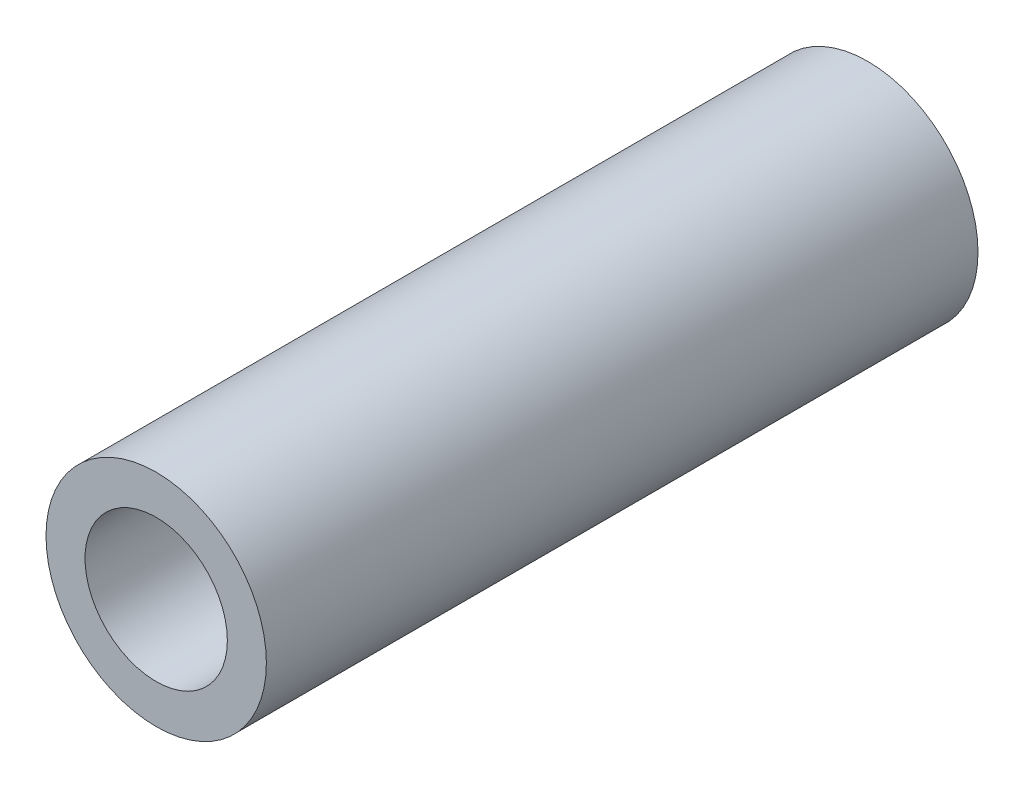
from build123d import *

# Parameters (mm, degrees)
SKETCH1_R           = 2.4
SKETCH1_R_2         = 1.55
BOSS_EXTRUDE1_DEPTH = 15.5


with BuildPart() as part:
    # Sketch1 → Boss-Extrude1 (new body)
    with BuildSketch(Plane.XY):
        Circle(SKETCH1_R)
        Circle(SKETCH1_R_2, mode=Mode.SUBTRACT)
    extrude(amount=BOSS_EXTRUDE1_DEPTH)


solid = part.part
